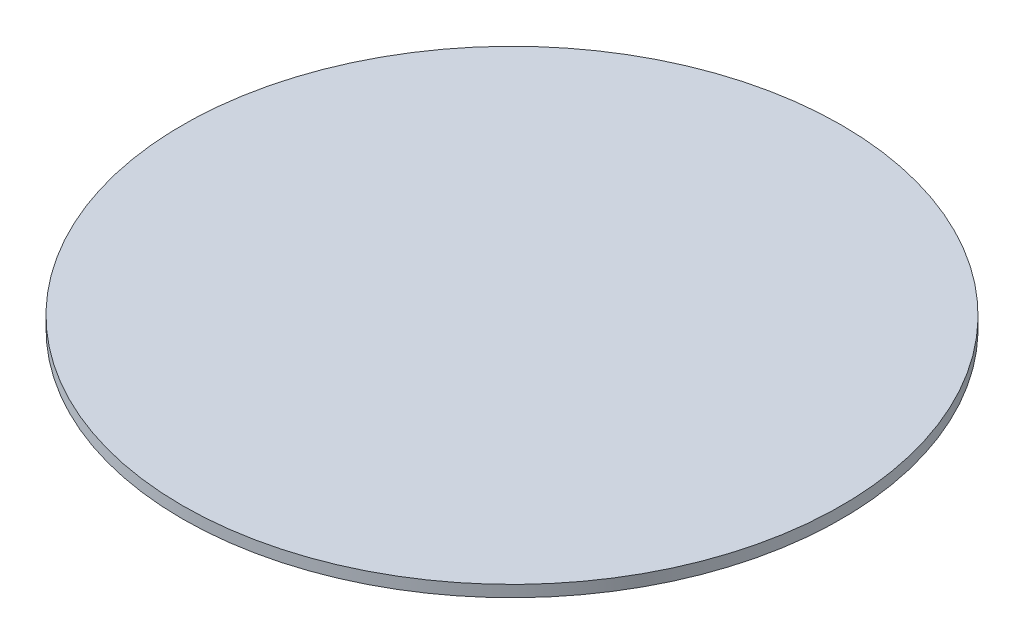
from build123d import *

# Parameters (mm, degrees)
SKETCH1_R           = 200
BOSS_EXTRUDE1_DEPTH = 7


with BuildPart() as part:
    # Sketch1 → Boss-Extrude1 (new body)
    with BuildSketch(Plane(origin=(0, 0, 0), x_dir=(1, 0, 0), z_dir=(0, 1, 0))):
        with Locations(Location((0, 0, 0), (0, 0, 270))):
            Circle(SKETCH1_R)
    extrude(amount=BOSS_EXTRUDE1_DEPTH)


solid = part.part
